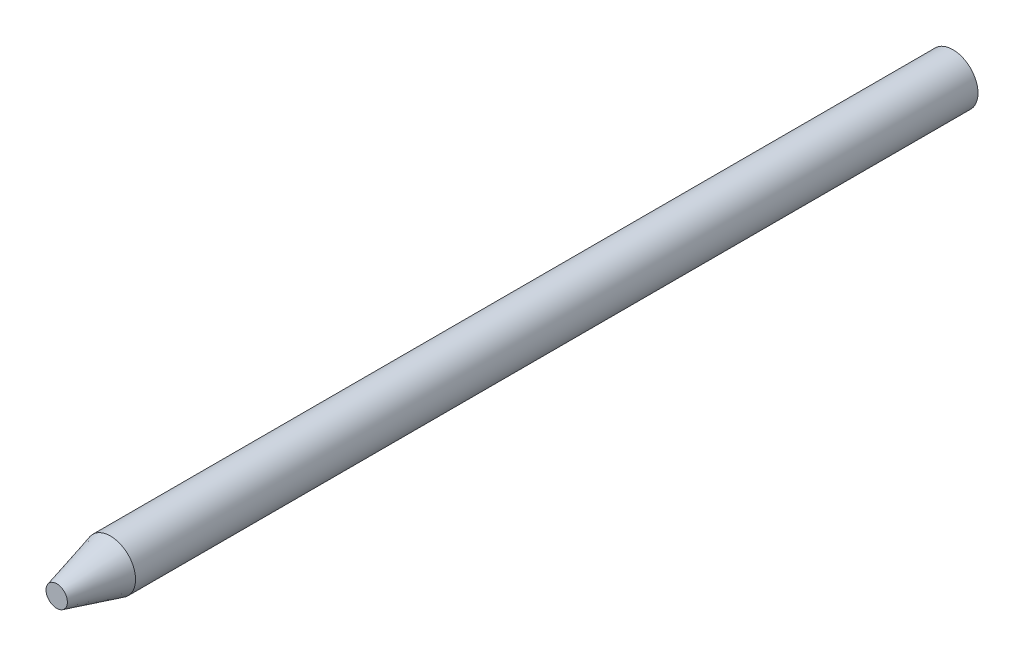
from build123d import *

# Parameters (mm, degrees)
SKETCH1_R           = 1.778
BOSS_EXTRUDE1_DEPTH = 63.5
CHAMFER1_SIZE       = 3.81
CHAMFER1_SIZE2      = 1.020886423


with BuildPart() as part:
    # Sketch1 → Boss-Extrude1 (new body)
    with BuildSketch(Plane.XY):
        Circle(SKETCH1_R)
    extrude(amount=BOSS_EXTRUDE1_DEPTH)

    # Chamfer1
    chamfer1_edges = [part.edges().sort_by_distance(p)[0] for p in [
        (-1.778, 0, 63.5),
    ]]
    chamfer1_side = [part.faces().sort_by_distance(p)[0] for p in [
        (-1.778, 0, 31.75),
    ]]
    chamfer(chamfer1_edges, length=CHAMFER1_SIZE, length2=CHAMFER1_SIZE2, reference=chamfer1_side[0])


solid = part.part
